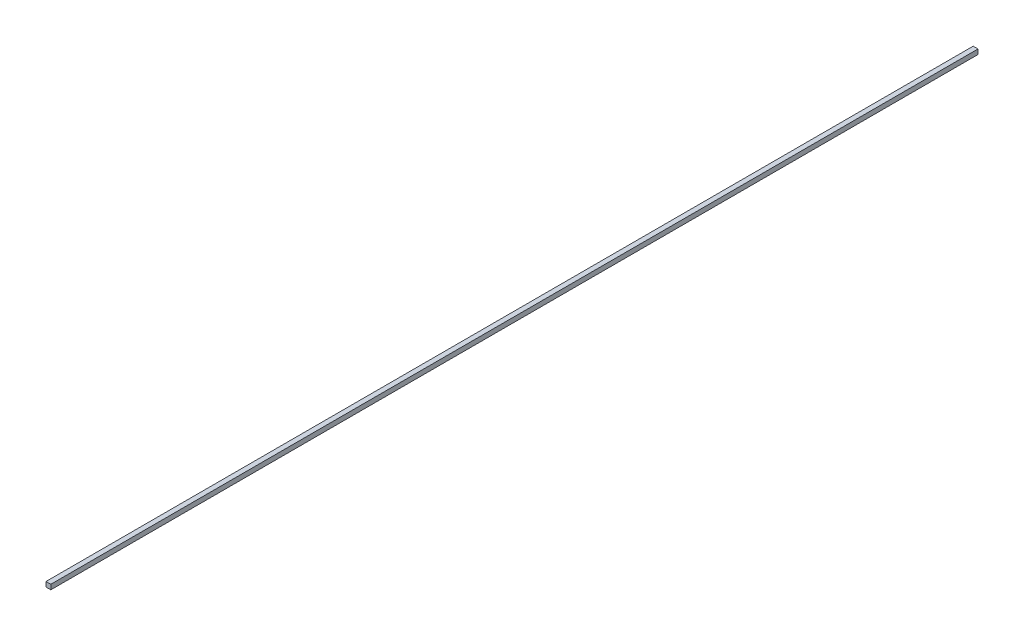
from build123d import *

# Parameters (mm, degrees)
BOSS_EXTRUDE1_DEPTH      = 609.6
BOSS_EXTRUDE1_DEPTH_BACK = 609.6
SKETCH3_W                = 6.35
SKETCH3_H                = 6.35


with BuildPart() as part:
    # Sketch3 → Boss-Extrude1 (new, two sides: drawn at the far end of the back side and taken through both)
    with BuildSketch(Plane.XY.offset(-BOSS_EXTRUDE1_DEPTH_BACK)):
        Rectangle(SKETCH3_W, SKETCH3_H)
    extrude(amount=BOSS_EXTRUDE1_DEPTH + BOSS_EXTRUDE1_DEPTH_BACK)


solid = part.part
